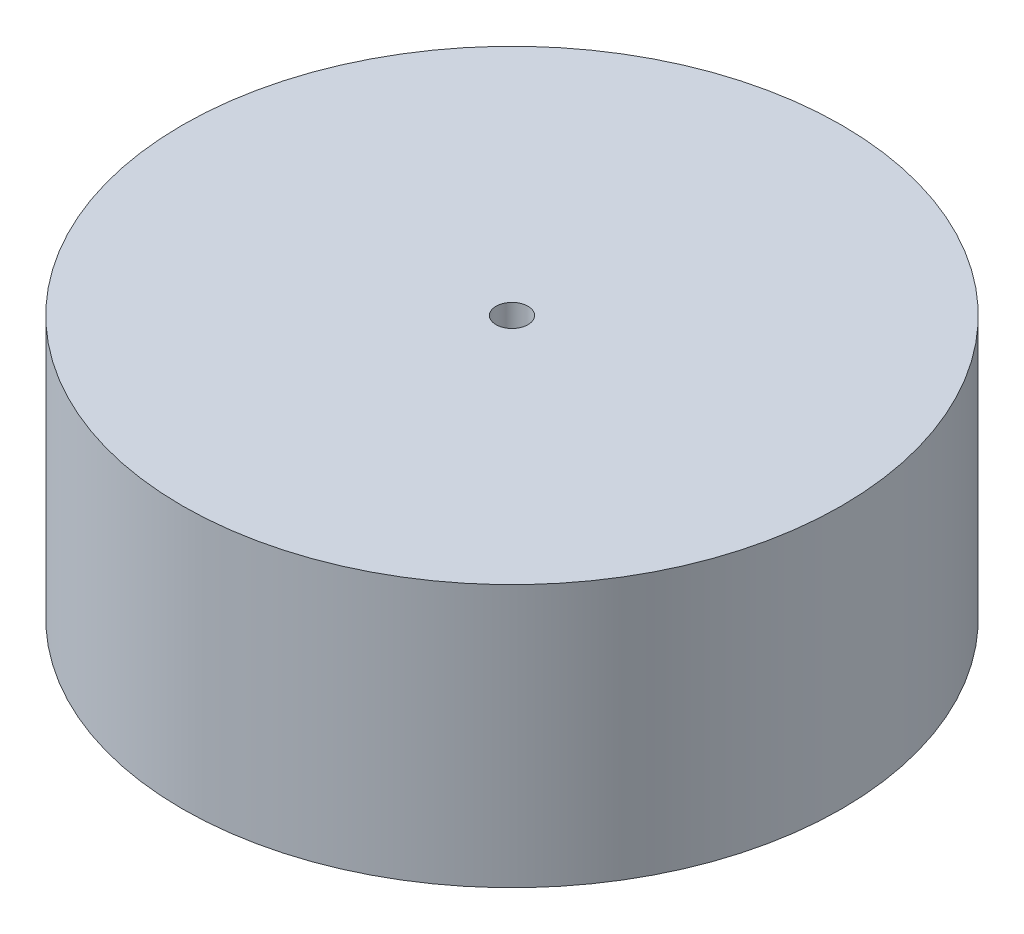
from build123d import *

# Parameters (mm, degrees)
SKETCH_1_R          = 51.5
EXTRUDE_1_DEPTH     = 41
SKETCH_2_R          = 2.5
CUT_EXTRUDE_1_DEPTH = 84.579303658


with BuildPart() as part:
    # 草图1 → 凸台-拉伸1 (new body)
    with BuildSketch(Plane(origin=(0, 0, 0), x_dir=(1, 0, 0), z_dir=(0, 1, 0))):
        with Locations(Location((0, 0, 0), (0, 0, 270))):
            Circle(SKETCH_1_R)
    extrude(amount=EXTRUDE_1_DEPTH)

    # 草图2 → 切除-拉伸1 (cut, through all)
    with BuildSketch(Plane(origin=(0, 41, 0), x_dir=(1, 0, 0), z_dir=(0, 1, 0))):
        with Locations(Location((0, 0, 0), (0, 0, 270))):
            Circle(SKETCH_2_R)
    extrude(amount=-CUT_EXTRUDE_1_DEPTH, mode=Mode.SUBTRACT)


solid = part.part
